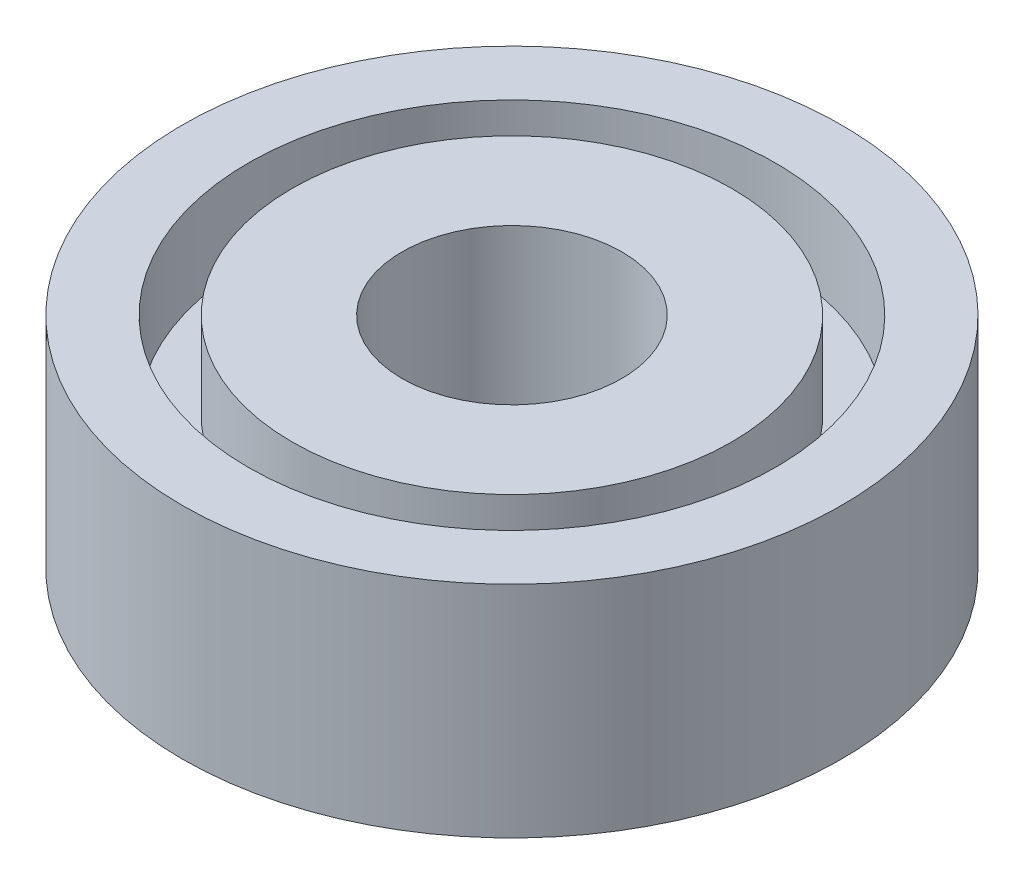
from build123d import *

# Parameters (mm, degrees)
SKETCH_1_R          = 1.5
SKETCH_1_R_2        = 0.5
EXTRUDE_1_DEPTH     = 1
SKETCH_1_3_R        = 1.2
SKETCH_1_3_R_2      = 1
CUT_EXTRUDE_1_DEPTH = 0.4
CUT_EXTRUDE_START   = 0.6
SKETCH_1_4_R        = 1.2
SKETCH_1_4_R_2      = 1
CUT_EXTRUDE_2_DEPTH = 0.4


with BuildPart() as part:
    # 草图1 → 凸台-拉伸1 (new body)
    with BuildSketch(Plane(origin=(0, 0, 0), x_dir=(1, 0, 0), z_dir=(0, 1, 0))):
        with Locations(Location((0, 0, 0), (0, 0, 270))):
            Circle(SKETCH_1_R)
        with Locations(Location((0, 0, 0), (0, 0, 270))):
            Circle(SKETCH_1_R_2, mode=Mode.SUBTRACT)
    extrude(amount=EXTRUDE_1_DEPTH)

    # 草图1<3> → 切除-拉伸-薄壁1 (cut)
    with BuildSketch(Plane(origin=(0, 0, 0), x_dir=(1, 0, 0), z_dir=(0, 1, 0))):
        Circle(SKETCH_1_3_R)
        Circle(SKETCH_1_3_R_2, mode=Mode.SUBTRACT)
    extrude(amount=CUT_EXTRUDE_1_DEPTH, mode=Mode.SUBTRACT)

    # 草图1<4> → 切除-拉伸-薄壁2 (cut)
    with BuildSketch(Plane(origin=(0, 0, 0), x_dir=(1, 0, 0), z_dir=(0, 1, 0)).offset(CUT_EXTRUDE_START)):
        Circle(SKETCH_1_4_R)
        Circle(SKETCH_1_4_R_2, mode=Mode.SUBTRACT)
    extrude(amount=CUT_EXTRUDE_2_DEPTH, mode=Mode.SUBTRACT)


solid = part.part
